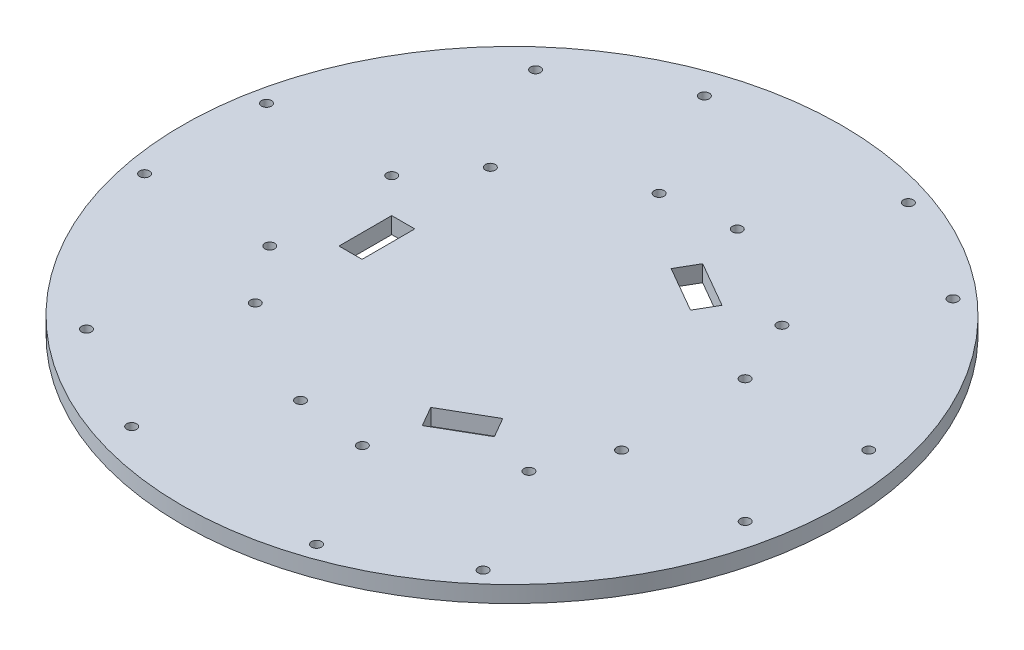
from build123d import *

# Parameters (mm, degrees)
ESBO_O1_R                = 100
RESSALTO_EXTRUS_O1_DEPTH = 5
ESBO_O2_R                = 1.5
CORTE_EXTRUS_O1_DEPTH    = 142.509716981


with BuildPart() as part:
    # Esboço1 → Ressalto-extrusão1 (new body)
    with BuildSketch(Plane(origin=(0, 0, 0), x_dir=(1, 0, 0), z_dir=(0, 1, 0))):
        with Locations(Location((0, 0, 0), (0, 0, 270))):
            Circle(ESBO_O1_R)
    extrude(amount=RESSALTO_EXTRUS_O1_DEPTH)

    # Esboço2 → Corte-extrusão1 (cut, through all)
    with BuildSketch(Plane(origin=(0, 5, 0), x_dir=(1, 0, 0), z_dir=(0, 1, 0))):
        with Locations(Location((-93, 18.5, 0), (0, 0, 270))):
            Circle(ESBO_O2_R)
        with Locations(Location((-55, 18.5, 0), (0, 0, 270))):
            Circle(ESBO_O2_R)
        with Locations(Location((-55, -18.5, 0), (0, 0, 270))):
            Circle(ESBO_O2_R)
        with Locations(Location((-93, -18.5, 0), (0, 0, 270))):
            Circle(ESBO_O2_R)
        with Locations(Location((52, 18.75, 0), (0, 0, 270))):
            Circle(ESBO_O2_R)
        with Locations(Location((89.5, 18.75, 0), (0, 0, 270))):
            Circle(ESBO_O2_R)
        with Locations(Location((52, -18.75, 0), (0, 0, 270))):
            Circle(ESBO_O2_R)
        with Locations(Location((89.5, -18.75, 0), (0, 0, 270))):
            Circle(ESBO_O2_R)
        with Locations(Location((30.47853003, -89.790362552, 0), (0, 0, 270))):
            Circle(ESBO_O2_R)
        with Locations(Location((11.47853003, -56.881397208, 0), (0, 0, 270))):
            Circle(ESBO_O2_R)
        with Locations(Location((43.52146997, -38.381397208, 0), (0, 0, 270))):
            Circle(ESBO_O2_R)
        with Locations(Location((62.52146997, -71.290362552, 0), (0, 0, 270))):
            Circle(ESBO_O2_R)
        with Locations(Location((-42.237976321, 35.658320997, 0), (0, 0, 270))):
            Circle(ESBO_O2_R)
        with Locations(Location((-60.987976321, 68.134273639, 0), (0, 0, 270))):
            Circle(ESBO_O2_R)
        with Locations(Location((-9.762023679, 54.408320997, 0), (0, 0, 270))):
            Circle(ESBO_O2_R)
        with Locations(Location((-28.512023679, 86.884273639, 0), (0, 0, 270))):
            Circle(ESBO_O2_R)
        with Locations(Location((62.52146997, 71.290362552, 0), (0, 0, 270))):
            Circle(ESBO_O2_R)
        with Locations(Location((43.52146997, 38.381397208, 0), (0, 0, 270))):
            Circle(ESBO_O2_R)
        with Locations(Location((11.47853003, 56.881397208, 0), (0, 0, 270))):
            Circle(ESBO_O2_R)
        with Locations(Location((30.47853003, 89.790362552, 0), (0, 0, 270))):
            Circle(ESBO_O2_R)
        with Locations(Location((-9.762023679, -54.408320997, 0), (0, 0, 270))):
            Circle(ESBO_O2_R)
        with Locations(Location((-28.512023679, -86.884273639, 0), (0, 0, 270))):
            Circle(ESBO_O2_R)
        with Locations(Location((-42.237976321, -35.658320997, 0), (0, 0, 270))):
            Circle(ESBO_O2_R)
        with Locations(Location((-60.987976321, -68.134273639, 0), (0, 0, 270))):
            Circle(ESBO_O2_R)
        Polygon((-37.5, 0), (-37.5, 8), (-44.5, 8), (-44.5, -8), (-37.5, -8), align=None)
        Polygon((18.75, -32.475952642), (11.82179677, -36.475952642), (15.32179677, -42.538130468), (29.17820323, -34.538130468), (25.67820323, -28.475952642), align=None)
        Polygon((18.75, 32.475952642), (25.67820323, 28.475952642), (29.17820323, 34.538130468), (15.32179677, 42.538130468), (11.82179677, 36.475952642), align=None)
    extrude(amount=-CORTE_EXTRUS_O1_DEPTH, mode=Mode.SUBTRACT)


solid = part.part
